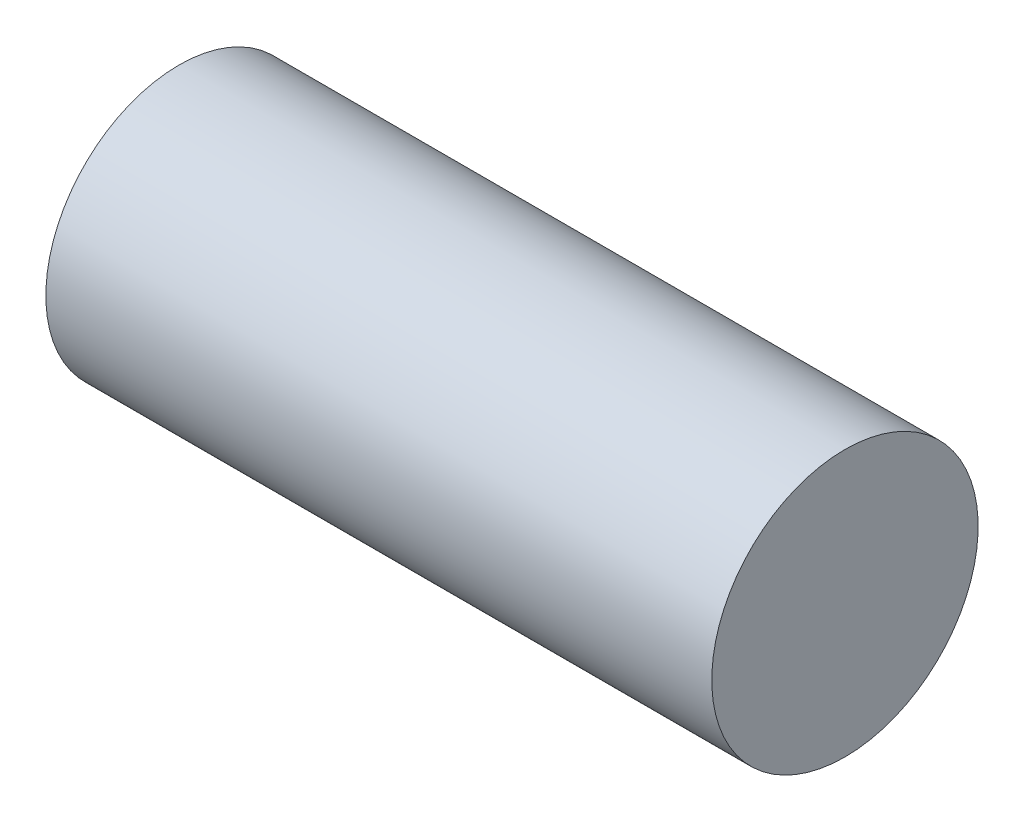
from build123d import *


with BuildPart() as part:
    # ｽｹｯﾁ1 → 回転1 (revolve)
    with BuildSketch(Plane.XY, mode=Mode.PRIVATE) as revolve_1_sk:
        Polygon((10, 0), (0, 0), (0, -60), (150, -60), (150, -10), (140, -10), (100, -50), (10, -50), align=None)
        Polygon((150, -10), (150, -60), (300, -60), (300, 0), (290, 0), (290, -50), (200, -50), (160, -10), align=None)
    revolve(revolve_1_sk.sketch.rotate(Axis((10, 0, 0), (-1, 0, 0)), 180), axis=Axis((10, 0, 0), (-1, 0, 0)))


solid = part.part
